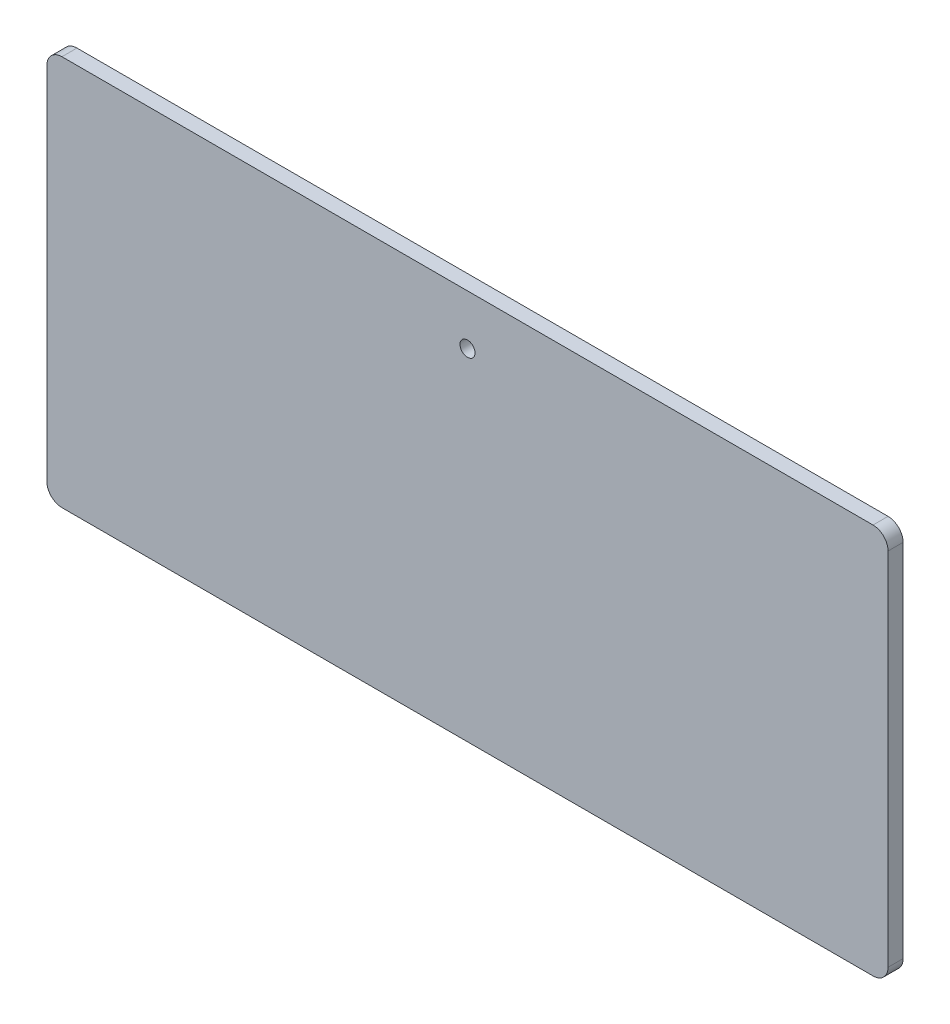
from build123d import *

# Parameters (mm, degrees)
ESQUISSE1_W             = 168
ESQUISSE1_H             = 78
BOSS_EXTRU_1_DEPTH      = 3
CONG_1_R                = 3
ESQUISSE2_R             = 1.5
ENL_V_MAT_EXTRU_1_DEPTH = 186.248481775


with BuildPart() as part:
    # Esquisse1 → Boss.-Extru.1 (new body)
    with BuildSketch(Plane.XY):
        with Locations((84, 39)):
            Rectangle(ESQUISSE1_W, ESQUISSE1_H)
    extrude(amount=BOSS_EXTRU_1_DEPTH)

    # Congé1
    cong_1_edges = [part.edges().sort_by_distance(p)[0] for p in [
        (0, 78, 1.5),
        (168, 78, 1.5),
        (168, 0, 1.5),
        (0, 0, 1.5),
    ]]
    fillet(cong_1_edges, radius=CONG_1_R)

    # Esquisse2 → Enlèv. mat.-Extru.1 (cut, through all)
    with BuildSketch(Plane.XY.offset(3)):
        with Locations((84, 68)):
            Circle(ESQUISSE2_R)
    extrude(amount=-ENL_V_MAT_EXTRU_1_DEPTH, mode=Mode.SUBTRACT)


solid = part.part
